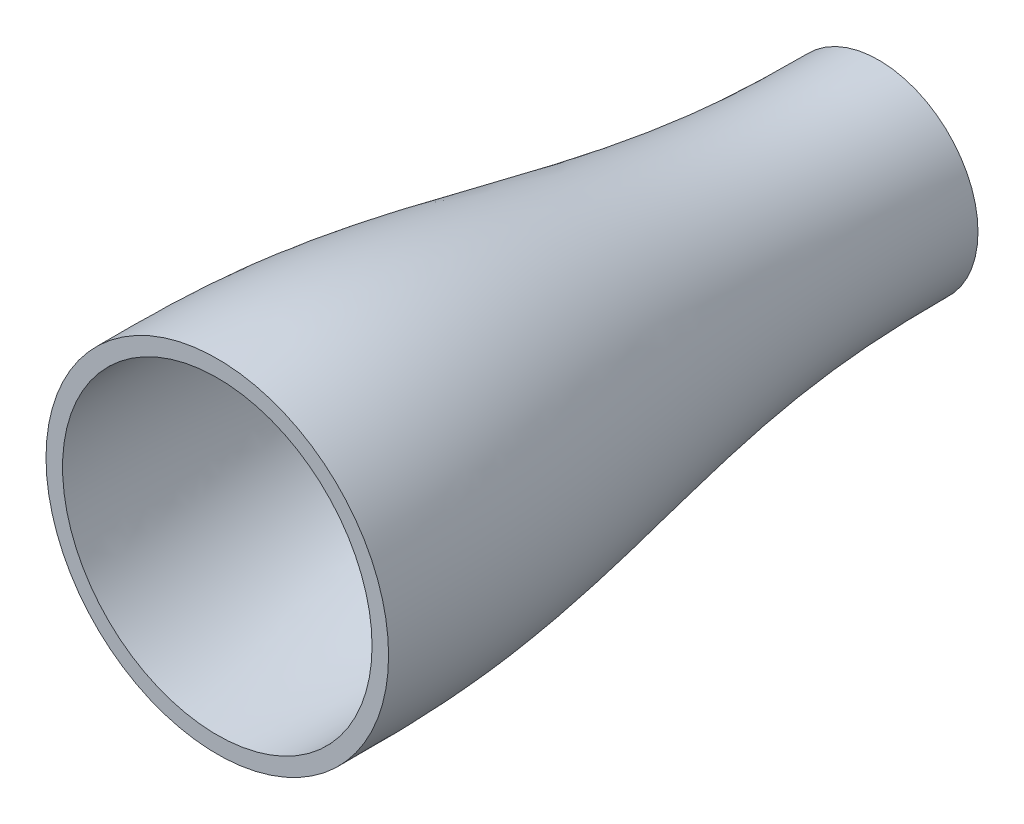
from build123d import *

# Parameters (mm, degrees)
VACIADO1_T = -30


with BuildPart() as part:
    # Croquis1 → Revolución2 (revolve)
    with BuildSketch(Plane(origin=(0, 0, 0), x_dir=(0, 0, -1), z_dir=(1, 0, 0))):
        with BuildLine():
            Line((0, 310.74), (0, 0))
            Line((0, 0), (1200, 0))
            Line((1200, 0), (1200, 180))
            add(Edge.make_bspline(
                [(0, 310.74), (239.898132517, 311.643385127), (479.796265033, 312.546770255), (720.153458385, 191.544410274), (960.098651242, 179.950702731), (1200, 180)],
                knots=[0, 0, 0, 0, 0, 0, 0.965828538, 0.965828538, 0.965828538, 0.965828538, 0.965828538, 0.965828538], degree=5))
        make_face()
    revolve(axis=Axis((0, 0, 0), (0, 0, -1)))

    # Vaciado1
    vaciado1_openings = [part.faces().sort_by_distance(p)[0] for p in [
        (0, 0, 0),
        (0, 0, -1200),
    ]]
    offset(amount=VACIADO1_T, openings=vaciado1_openings, kind=Kind.INTERSECTION)


solid = part.part
